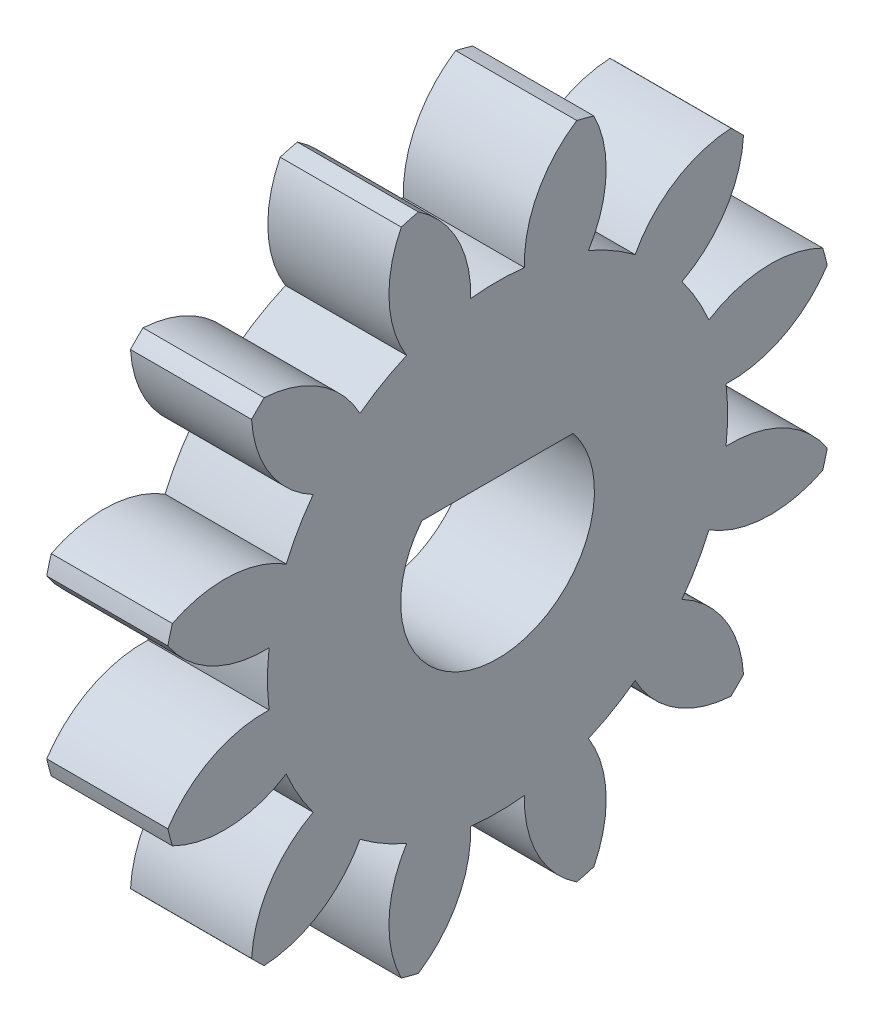
from build123d import *

# Parameters (mm, degrees)
BASPROSKE_W         = 5
BASPROSKE_H         = 14
TOOTHCUT_DEPTH      = 21.420577857
TEETHCUTS_COUNT     = 12
TEETHCUTS_ANGLE     = 330
BORSKE_R            = 4
BORE_DEPTH          = 50.0000508
BOSS_EXTRUDE1_DEPTH = 5


with BuildPart() as part:
    # BasProSke → Base-Revolve (revolve)
    with BuildSketch(Plane(origin=(0, 0, 0), x_dir=(1, 0, 0), z_dir=(0, 1, 0)), mode=Mode.PRIVATE) as base_revolve_sk:
        with Locations((2.5, 7)):
            Rectangle(BASPROSKE_W, BASPROSKE_H)
    revolve(base_revolve_sk.sketch.rotate(Axis((-10, 0, 0), (1, 0, 0)), 180), axis=Axis((-10, 0, 0), (1, 0, 0)))

    # TooCutSke → ToothCut (cut, through all)
    with BuildSketch(Plane(origin=(0, 0, 0), x_dir=(0, 0, -1), z_dir=(1, 0, 0))):
        with BuildLine():
            ThreePointArc((1.111908866, 9.433698091), (0, 9.499), (-1.111908866, 9.433698091))
            ThreePointArc((-1.111908866, 9.433698091), (-1.651516138, 11.821129337), (-3.298149691, 13.632096456))
            ThreePointArc((-3.298149691, 13.632096456), (0, 14.0254), (3.298149691, 13.632096456))
            ThreePointArc((3.298149691, 13.632096456), (1.651516138, 11.821129337), (1.111908866, 9.433698091))
        make_face()
    toothcut = extrude(amount=TOOTHCUT_DEPTH, mode=Mode.SUBTRACT)

    # TeethCuts: ToothCut ×12 about axis
    teethcuts_axis = Axis((-10, 0, 0), (1, 0, 0))
    for i in range(1, TEETHCUTS_COUNT):
        add(toothcut.rotate(teethcuts_axis, i * TEETHCUTS_ANGLE / (TEETHCUTS_COUNT - 1)), mode=Mode.SUBTRACT)

    # BorSke → Bore (cut, symmetric)
    with BuildSketch(Plane(origin=(0, 0, 0), x_dir=(0, 0, -1), z_dir=(1, 0, 0))):
        with Locations(Location((0, 0, 0), (0, 0, 180))):
            Circle(BORSKE_R)
    extrude(amount=BORE_DEPTH, both=True, mode=Mode.SUBTRACT)

    # Sketch1 → Boss-Extrude1 (add)
    with BuildSketch(Plane(origin=(5, 0, 0), x_dir=(0, 0, -1), z_dir=(1, 0, 0))):
        with BuildLine():
            Line((-3.122498999, 2.5), (3.122498999, 2.5))
            ThreePointArc((3.122498999, 2.5), (0, 4), (-3.122498999, 2.5))
        make_face()
    extrude(amount=-BOSS_EXTRUDE1_DEPTH)


solid = part.part
